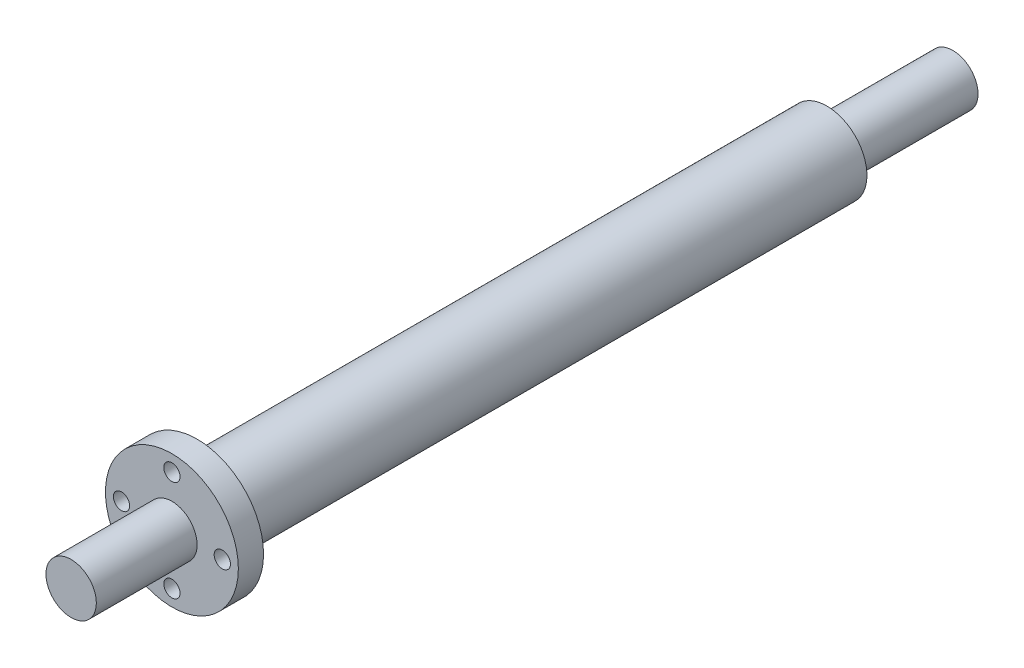
from build123d import *

# Parameters (mm, degrees)
SZKIC1_R                    = 26.376993093
SZKIC1_R_2                  = 3.228518126
DODANIE_WYCI_GNI_CIE1_DEPTH = 10
SZKIC2_R                    = 10
DODANIE_WYCI_GNI_CIE2_DEPTH = 40
SZKIC3_R                    = 15.88
DODANIE_WYCI_GNI_CIE3_DEPTH = 300
SZKIC4_R                    = 15.88
SZKIC4_R_2                  = 10
WYTNIJ_WYCI_GNI_CIE1_DEPTH  = 50


with BuildPart() as part:
    # Szkic1 → Dodanie-wyciągnięcie1 (new body)
    with BuildSketch(Plane.XY):
        Circle(SZKIC1_R)
        with Locations((0, 20)):
            Circle(SZKIC1_R_2, mode=Mode.SUBTRACT)
        with Locations((20, 0)):
            Circle(SZKIC1_R_2, mode=Mode.SUBTRACT)
        with Locations((0, -20)):
            Circle(SZKIC1_R_2, mode=Mode.SUBTRACT)
        with Locations((-20, 0)):
            Circle(SZKIC1_R_2, mode=Mode.SUBTRACT)
    extrude(amount=DODANIE_WYCI_GNI_CIE1_DEPTH)

    # Szkic2 → Dodanie-wyciągnięcie2 (add)
    with BuildSketch(Plane.XY.offset(10)):
        Circle(SZKIC2_R)
    extrude(amount=DODANIE_WYCI_GNI_CIE2_DEPTH)

    # Szkic3 → Dodanie-wyciągnięcie3 (add)
    with BuildSketch(Plane(origin=(0, 0, 0), x_dir=(-1, 0, 0), z_dir=(0, 0, -1))):
        Circle(SZKIC3_R)
    extrude(amount=DODANIE_WYCI_GNI_CIE3_DEPTH)

    # Szkic4 → Wytnij-wyciągnięcie1 (cut)
    with BuildSketch(Plane(origin=(0, 0, -300), x_dir=(-1, 0, 0), z_dir=(0, 0, -1))):
        Circle(SZKIC4_R)
        with Locations(Location((0, 0, 0), (0, 0, 180))):
            Circle(SZKIC4_R_2, mode=Mode.SUBTRACT)
    extrude(amount=-WYTNIJ_WYCI_GNI_CIE1_DEPTH, mode=Mode.SUBTRACT)


solid = part.part
